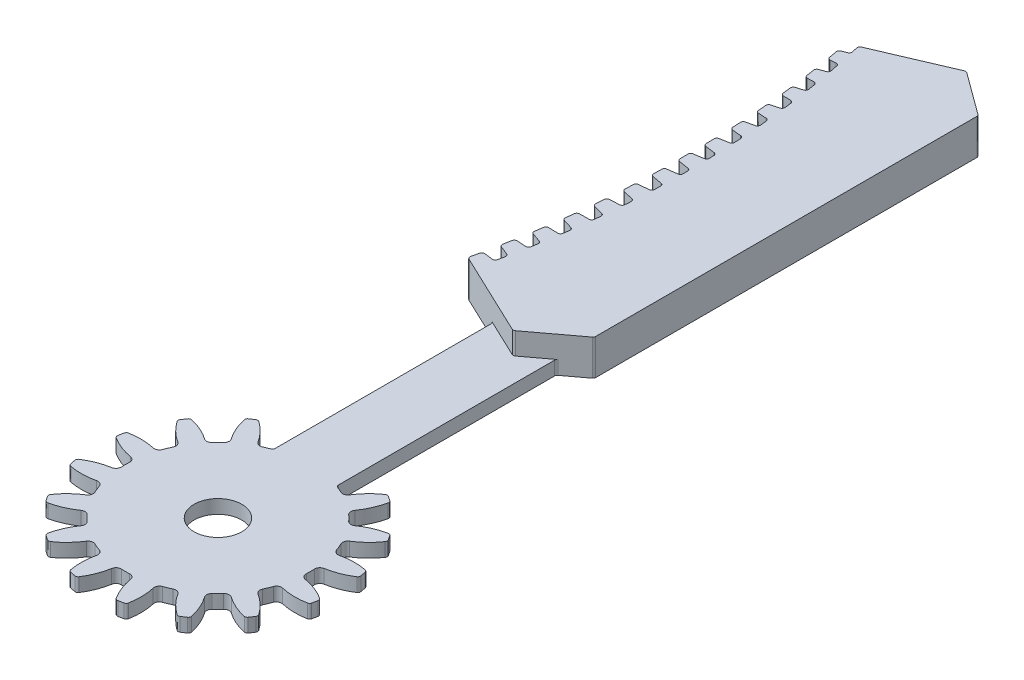
from build123d import *

# Parameters (mm, degrees)
SKETCH1_R                = 22.5
SKETCH1_R_2              = 4.35
BOSS_EXTRUDE1_DEPTH      = 2.5
CUT_EXTRUDE2_DEPTH       = 32.917863337009265
FILLET1_R                = 0.95
FILLET2_R                = 0.5
CIRPATTERN1_COUNT        = 16
FILLET1_OF_CIRPATTERN1_R = 0.95
FILLET2_OF_CIRPATTERN1_R = 0.5
BOSS_EXTRUDE3_DEPTH      = 2.5
BOSS_EXTRUDE4_DEPTH      = 6.5
FILLET5_R                = 0.5
BOSS_EXTRUDE5_DEPTH      = 6.5
FILLET6_R                = 0.5


with BuildPart() as part:
    # Sketch1 → Boss-Extrude1 (new body)
    with BuildSketch(Plane(origin=(0, 0, 0), x_dir=(1, 0, 0), z_dir=(0, 1, 0))):
        with Locations(Location((0, 0, 0), (0, 0, 270))):
            Circle(SKETCH1_R)
        with Locations(Location((0, 0, 0), (0, 0, 270))):
            Circle(SKETCH1_R_2, mode=Mode.SUBTRACT)
    extrude(amount=BOSS_EXTRUDE1_DEPTH)

    # Sketch3 → Cut-Extrude2 (cut, through all)
    with BuildSketch(Plane(origin=(0, 2.5, 0), x_dir=(1, 0, 0), z_dir=(0, 1, 0))):
        with BuildLine():
            ThreePointArc((1.605916203506758, 16.798412369843604), (-2.71e-15, 16.875000000000004), (-1.605916203506762, 16.798412369843604))
            ThreePointArc((-1.605916203506762, 16.798412369843604), (-2.2460398817052827, 19.63184994026773), (-3.5769752582013883, 22.213852615028653))
            ThreePointArc((-3.5769752582013883, 22.213852615028653), (1.38e-15, 22.500000000000004), (3.5769752582013874, 22.213852615028657))
            ThreePointArc((3.5769752582013874, 22.213852615028657), (2.246039881705281, 19.63184994026773), (1.605916203506758, 16.798412369843604))
        make_face()
    cut_extrude2 = extrude(amount=-CUT_EXTRUDE2_DEPTH, mode=Mode.SUBTRACT)

    # Fillet1
    fillet1_edges = [part.edges().sort_by_distance(p)[0] for p in [
        (1.6059162035067573, 1.25, -16.798412369843604),
        (-1.6059162035067611, 1.25, -16.798412369843604),
    ]]
    fillet(fillet1_edges, radius=FILLET1_R)

    # Fillet2
    fillet2_edges = [part.edges().sort_by_distance(p)[0] for p in [
        (-3.5769752582013874, 1.25, -22.213852615028653),
        (3.5769752582013874, 1.25, -22.213852615028657),
    ]]
    fillet(fillet2_edges, radius=FILLET2_R)

    # CirPattern1: Cut-Extrude2 ×16 about axis
    cirpattern1_axis = Axis((-6.88e-15, 0, 0), (0, 1, 0))
    for i in range(1, CIRPATTERN1_COUNT):
        add(cut_extrude2.rotate(cirpattern1_axis, i * 360 / CIRPATTERN1_COUNT), mode=Mode.SUBTRACT)

    # Fillet1 of CirPattern1
    fillet1_of_cirpattern1_edges = [part.edges().sort_by_distance(p)[0] for p in [
        (-4.94480099262781, 1.25, -16.134266892031608),
        (-7.91214721532406, 1.25, -14.905151842334245),
        (-10.74271706236741, 1.25, -13.013825537401383),
        (-13.013825537401381, 1.25, -10.742717062367413),
        (-14.905151842334249, 1.25, -7.912147215324063),
        (-16.134266892031608, 1.25, -4.944800992627813),
        (-16.79841236984361, 1.25, -1.6059162035067653),
        (-16.79841236984361, 1.25, 1.6059162035067531),
        (-16.134266892031615, 1.2499999999999998, 4.944800992627802),
        (-14.905151842334252, 1.2499999999999998, 7.912147215324052),
        (-13.01382553740139, 1.25, 10.742717062367403),
        (-10.74271706236742, 1.25, 13.013825537401374),
        (-7.912147215324071, 1.25, 14.905151842334243),
        (-4.944800992627821, 1.25, 16.134266892031604),
        (-1.605916203506773, 1.25, 16.798412369843604),
        (1.6059162035067454, 1.25, 16.798412369843604),
        (4.944800992627793, 1.25, 16.13426689203161),
        (7.912147215324044, 1.25, 14.905151842334247),
        (10.742717062367396, 1.25, 13.013825537401384),
        (13.013825537401367, 1.25, 10.742717062367415),
        (14.905151842334238, 1.25, 7.912147215324057),
        (16.134266892031597, 1.25, 4.944800992627807),
        (16.798412369843597, 1.25, 1.6059162035067673),
        (16.798412369843597, 1.25, -1.6059162035067511),
        (16.1342668920316, 1.25, -4.9448009926278065),
        (14.905151842334238, 1.25, -7.912147215324056),
        (13.013825537401377, 1.25, -10.7427170623674),
        (10.742717062367408, 1.25, -13.013825537401372),
        (7.912147215324052, 1.25, -14.905151842334245),
        (4.944800992627801, 1.25, -16.134266892031604),
    ]]
    fillet(fillet1_of_cirpattern1_edges, radius=FILLET1_OF_CIRPATTERN1_R)

    # Fillet2 of CirPattern1
    fillet2_of_cirpattern1_edges = [part.edges().sort_by_distance(p)[0] for p in [
        (-11.805567594122927, 1.25, -19.154074599953788),
        (-5.1961791354198565, 1.25, -21.891772938540814),
        (-18.236869281575988, 1.25, -13.178262359154587),
        (-13.178262359154582, 1.25, -18.23686928157599),
        (-21.89177293854081, 1.25, -5.196179135419862),
        (-19.15407459995379, 1.25, -11.805567594122936),
        (-22.21385261502866, 1.25, 3.5769752582013794),
        (-22.213852615028664, 1.25, -3.5769752582013954),
        (-19.154074599953795, 1.2499999999999998, 11.805567594122918),
        (-21.89177293854082, 1.2499999999999998, 5.196179135419848),
        (-13.178262359154594, 1.25, 18.23686928157598),
        (-18.236869281576, 1.25, 13.178262359154575),
        (-5.196179135419869, 1.25, 21.891772938540804),
        (-11.805567594122943, 1.25, 19.154074599953784),
        (3.576975258201371, 1.25, 22.213852615028653),
        (-3.576975258201404, 1.25, 22.213852615028657),
        (11.805567594122914, 1.25, 19.15407459995379),
        (5.196179135419838, 1.25, 21.891772938540814),
        (18.236869281575974, 1.25, 13.178262359154589),
        (13.178262359154568, 1.25, 18.236869281575995),
        (21.891772938540797, 1.25, 5.196179135419854),
        (19.154074599953784, 1.25, 11.80556759412293),
        (22.213852615028646, 1.25, -3.5769752582013767),
        (22.21385261502865, 1.25, 3.576975258201398),
        (19.15407459995378, 1.25, -11.805567594122925),
        (21.891772938540804, 1.25, -5.196179135419855),
        (13.178262359154582, 1.25, -18.236869281575977),
        (18.236869281575988, 1.25, -13.178262359154571),
        (5.196179135419847, 1.25, -21.891772938540804),
        (11.805567594122923, 1.25, -19.15407459995379),
    ]]
    fillet(fillet2_of_cirpattern1_edges, radius=FILLET2_OF_CIRPATTERN1_R)

    # Sketch4 → Boss-Extrude3 (add)
    with BuildSketch(Plane(origin=(0, 0, 0), x_dir=(1, 0, 0), z_dir=(0, 1, 0))):
        Polygon((1.2983995879278214, 52.50768205597929), (5.766865712416592, 55.85903164934587), (5.766865712416592, 15.859031649345871), (-5.766865712416817, 15.859031649345788), (-5.766865712416816, 55.85903164934579), align=None)
    extrude(amount=BOSS_EXTRUDE3_DEPTH)

    # Sketch4<3> → Boss-Extrude4 (add)
    with BuildSketch(Plane(origin=(0, 0, 0), x_dir=(1, 0, 0), z_dir=(0, 1, 0))):
        with BuildLine():
            Line((1.697049821836042, 134.76479760238988), (-12.09142103275468, 128.85903164934578))
            ThreePointArc((-12.09142103275468, 128.85903164934578), (-7.950942490902349, 93.85903164934585), (-12.09142103275358, 58.85903164934579))
            Line((-12.09142103275358, 58.85903164934579), (-5.766865712416816, 55.85903164934579))
            Line((-5.766865712416816, 55.85903164934579), (1.2983995879278214, 52.50768205597929))
            Line((1.2983995879278214, 52.50768205597929), (5.766865712416592, 55.85903164934587))
            Line((5.766865712416592, 55.85903164934587), (9.76686571241659, 58.85903164934587))
            Line((9.76686571241659, 58.85903164934587), (9.76686571241659, 128.8590316493459))
            Line((9.76686571241659, 128.8590316493459), (1.697049821836042, 134.76479760238988))
        make_face()
    extrude(amount=BOSS_EXTRUDE4_DEPTH)

    # Fillet5
    fillet5_edges = [part.edges().sort_by_distance(p)[0] for p in [
        (-5.7668657124168075, 1.2500000000000002, -15.859031649345795),
        (5.766865712416803, 1.2499999999999998, -15.859031649345793),
        (5.766865712416592, 1.25, -55.85903164934587),
        (-5.766865712416816, 1.25, -55.85903164934579),
        (1.697049821836042, 3.25, -134.76479760238988),
        (1.2983995879278214, 4.5, -52.50768205597929),
        (9.76686571241659, 3.25, -58.85903164934587),
        (9.76686571241659, 3.25, -128.8590316493459),
    ]]
    fillet(fillet5_edges, radius=FILLET5_R)

    # Sketch6 → Boss-Extrude5 (add)
    with BuildSketch(Plane(origin=(0, 0, 0), x_dir=(1, 0, 0), z_dir=(0, 1, 0))):
        with BuildLine():
            ThreePointArc((-13.87426551360329, 62.12954983497174), (-14.108237815682912, 61.02914144240931), (-14.350190790016683, 59.93046022077435))
            Line((-14.35019079001671, 59.93046022077435), (-12.09142103275358, 58.85903164934578))
            ThreePointArc((-12.091421032753573, 58.85903164934578), (-11.745508991646659, 60.333351711500036), (-11.41449869428186, 61.81108882238673))
            Line((-11.414498694281876, 61.81108882238673), (-13.87426551360333, 62.12954983497174))
        make_face()
        with BuildLine():
            Line((-12.925824147474163, 124.10752568322631), (-10.39160403870473, 124.26799571731279))
            ThreePointArc((-10.391604038704742, 124.26799571731279), (-10.67772165376428, 125.79013519452424), (-10.979540373734352, 127.30923931801563))
            Line((-10.979540373734338, 127.30923931801563), (-11.666221244835802, 127.03704138411108))
            Line((-11.666221244835802, 127.03704138411108), (-13.340138954285079, 126.37350616533111))
            ThreePointArc((-13.340138954285067, 126.37350616533111), (-13.128771984430784, 125.2412856068615), (-12.925824147474145, 124.10752568322631))
        make_face()
        with BuildLine():
            Line((-12.142011917300582, 119.16477330683823), (-9.559295134789458, 119.22617849462226))
            ThreePointArc((-9.559295134789437, 119.22617849462226), (-9.794490469822733, 120.76407589040942), (-10.045623786184734, 122.29945118752845))
            Line((-10.04562378618476, 122.29945118752845), (-12.482958165368771, 121.4429480060988))
            ThreePointArc((-12.482958165368757, 121.44294800609882), (-12.308252821395257, 120.30449404051488), (-12.142011917300579, 119.16477330683823))
        make_face()
        with BuildLine():
            Line((-11.518175015755538, 114.19929345220889), (-8.899179377850125, 114.15871855978668))
            ThreePointArc((-8.89917937785009, 114.15871855978668), (-9.082546978756739, 115.7093619712128), (-9.282046082505246, 117.25801260129856))
            Line((-9.282046082505268, 117.25801260129856), (-11.785397281387196, 116.48728745682806))
            ThreePointArc((-11.785397281387162, 116.48728745682806), (-11.64753568707215, 115.34378687974927), (-11.518175015755531, 114.19929345220889))
        make_face()
        with BuildLine():
            Line((-11.054963769443741, 109.21626244610927), (-8.412070592006991, 109.07181788575707))
            ThreePointArc((-8.412070592006984, 109.07181788575707), (-8.54289856830016, 110.6321415601842), (-8.690006881268403, 112.19101457381113))
            Line((-8.690006881268431, 112.19101457381113), (-11.248183483435511, 111.51169060803194))
            ThreePointArc((-11.248183483435497, 111.51169060803194), (-11.147309354327632, 110.36433547598111), (-11.05496376944373, 109.21626244610927))
        make_face()
        with BuildLine():
            Line((-10.752861058740207, 104.2208749117287), (-8.098537882823052, 103.97170589254574))
            ThreePointArc((-8.098537882823024, 103.97170589254574), (-8.176311205633965, 105.53860324167889), (-8.270467982568562, 107.10460148363794))
            Line((-8.27046798256858, 107.10460148363794), (-10.871876796777112, 106.52134433306908))
            ThreePointArc((-10.871876796777116, 106.52134433306908), (-10.808095290377736, 105.37133072079831), (-10.752861058740194, 104.2208749117287))
        make_face()
        with BuildLine():
            Line((-10.612181814405957, 99.21833835347418), (-7.958904637315803, 98.86462827676965))
            ThreePointArc((-7.958904637315783, 98.86462827676965), (-7.983307515275612, 100.4349650978318), (-8.024150533446516, 102.00496034620136))
            Line((-8.024150533446539, 102.00496034620136), (-10.656869507038714, 101.52145088102245))
            ThreePointArc((-10.656869507038692, 101.52145088102245), (-10.630247113179422, 100.36997763464986), (-10.612181814405943, 99.21833835347418))
        make_face()
        with BuildLine():
            ThreePointArc((-7.951026880501672, 94.01814441653903), (-7.96091969410088, 95.58907830044666), (-7.987264287578142, 97.15982242275447))
            Line((-7.987264287578148, 97.15982242275447), (-10.628690893228491, 96.74072690087189))
            ThreePointArc((-10.628690893228509, 96.74072690087189), (-10.611229790593597, 95.58907830044666), (-10.602326833132679, 94.4373317457242))
            Line((-10.602326833132677, 94.4373317457242), (-7.951026880501673, 94.01814441653903))
        make_face()
        with BuildLine():
            ThreePointArc((-8.024150533446544, 89.17319625469196), (-7.983307515275641, 90.74319150306152), (-7.958904637315811, 92.31352832412368))
            Line((-7.958904637315803, 92.31352832412368), (-10.612181814405957, 91.95981824741914))
            ThreePointArc((-10.612181814405943, 91.95981824741914), (-10.630247113179422, 90.80817896624346), (-10.656869507038692, 89.65670571987087))
            Line((-10.656869507038714, 89.65670571987087), (-8.024150533446539, 89.17319625469196))
        make_face()
        with BuildLine():
            ThreePointArc((-8.270467982568562, 84.0735551172554), (-8.176311205633965, 85.63955335921443), (-8.098537882823024, 87.20645070834757))
            Line((-8.098537882823052, 87.20645070834757), (-10.752861058740207, 86.95728168916463))
            ThreePointArc((-10.752861058740194, 86.95728168916463), (-10.808095290377736, 85.806825880095), (-10.871876796777116, 84.65681226782425))
            Line((-10.871876796777112, 84.65681226782425), (-8.27046798256858, 84.0735551172554))
        make_face()
        with BuildLine():
            ThreePointArc((-8.690006881268431, 78.9871420270822), (-8.54289856830016, 80.54601504070914), (-8.412070592006984, 82.10633871513626))
            Line((-8.412070592006991, 82.10633871513626), (-11.054963769443741, 81.96189415478405))
            ThreePointArc((-11.05496376944373, 81.96189415478405), (-11.147309354327632, 80.81382112491221), (-11.248183483435497, 79.66646599286138))
            Line((-11.248183483435511, 79.66646599286138), (-8.690006881268431, 78.9871420270822))
        make_face()
        with BuildLine():
            ThreePointArc((-9.282046082505246, 73.92014399959476), (-9.082546978756739, 75.46879462968052), (-8.89917937785009, 77.01943804110664))
            Line((-8.899179377850125, 77.01943804110664), (-11.518175015755538, 76.97886314868444))
            ThreePointArc((-11.518175015755531, 76.97886314868444), (-11.647535687072178, 75.83436972114406), (-11.78539728138719, 74.69086914406526))
            Line((-11.785397281387196, 74.69086914406526), (-9.282046082505268, 73.92014399959476))
        make_face()
        with BuildLine():
            ThreePointArc((-10.045623786184734, 68.87870541336488), (-9.794490469822733, 70.41408071048392), (-9.559295134789437, 71.95197810627104))
            Line((-9.559295134789458, 71.95197810627106), (-12.142011917300582, 72.0133832940551))
            ThreePointArc((-12.142011917300579, 72.0133832940551), (-12.308252821395229, 70.87366256037845), (-12.482958165368728, 69.73520859479453))
            Line((-12.482958165368771, 69.73520859479453), (-10.04562378618476, 68.87870541336488))
        make_face()
        with BuildLine():
            ThreePointArc((-10.979540373734352, 63.8689172828777), (-10.67772165376428, 65.38802140636909), (-10.391604038704742, 66.91016088358055))
            Line((-10.39160403870473, 66.91016088358055), (-12.925824147474163, 67.070630917667))
            ThreePointArc((-12.925824147474145, 67.07063091766699), (-13.128771984430784, 65.93687099403184), (-13.340138954285095, 64.80465043556224))
            Line((-13.340138954285079, 64.80465043556224), (-10.979540373734338, 63.8689172828777))
        make_face()
    extrude(amount=BOSS_EXTRUDE5_DEPTH)

    # Fillet6
    fillet6_edges = [part.edges().sort_by_distance(p)[0] for p in [
        (-11.414498694281853, 3.25, -61.81108882238673),
        (-13.874265513603325, 3.25, -62.12954983497174),
        (-14.350190790016725, 3.25, -59.93046022077435),
        (-10.6286908932285, 3.25, -96.74072690087189),
        (-10.602326833132679, 3.25, -94.4373317457242),
        (-7.951026880501672, 3.25, -94.01814441653903),
        (-7.987264287578131, 3.25, -97.15982242275447),
        (-10.752861058740201, 3.25, -86.95728168916463),
        (-10.871876796777128, 3.25, -84.65681226782425),
        (-8.27046798256857, 3.25, -84.0735551172554),
        (-8.098537882823052, 3.25, -87.20645070834757),
        (-12.091421032754681, 3.25, -128.85903164934578),
        (-12.925824147474168, 3.25, -124.10752568322631),
        (-11.05691508385047, 3.25, -124.22586737742502),
        (-13.340138954285074, 3.25, -126.37350616533111),
        (-11.666221244834901, 3.25, -127.0370413841114),
        (-12.14201191730058, 3.25, -119.16477330683823),
        (-10.109233080887918, 3.25, -119.21310348652288),
        (-12.482958165368764, 3.25, -121.44294800609882),
        (-10.632158891849429, 3.25, -122.09333700462747),
        (-11.51817501575555, 3.25, -114.19929345220889),
        (-9.33179649784941, 3.25, -114.16542089744999),
        (-11.78539728138718, 3.25, -116.48728745682806),
        (-9.763872039971716, 3.25, -117.1096693001893),
        (-11.054963769443722, 3.25, -109.21626244610927),
        (-8.726116741460402, 3.25, -109.08898174934997),
        (-11.24818348343549, 3.25, -111.51169060803194),
        (-9.063192944201575, 3.25, -112.09191499013482),
        (-10.752861058740216, 3.25, -104.2208749117287),
        (-8.293455501803152, 3.25, -103.99000337507664),
        (-10.871876796777128, 3.25, -106.52134433306908),
        (-8.531722909722873, 3.25, -107.04602599040834),
        (-10.612181814405936, 3.25, -99.21833835347418),
        (-8.034824017687583, 3.25, -98.87474913790189),
        (-10.656869507038689, 3.25, -101.52145088102245),
        (-8.170830341244141, 3.25, -101.97802200749823),
        (-7.958904637315808, 3.25, -92.31352832412368),
        (-10.612181814405936, 3.25, -91.95981824741914),
        (-10.656869507038703, 3.25, -89.65670571987087),
        (-8.02415053344654, 3.25, -89.17319625469196),
        (-8.412070592006987, 3.25, -82.10633871513626),
        (-11.054963769443736, 3.25, -81.96189415478405),
        (-11.248183483435504, 3.25, -79.66646599286138),
        (-8.690006881268445, 3.25, -78.9871420270822),
        (-8.899179377850093, 3.25, -77.01943804110664),
        (-11.51817501575552, 3.25, -76.97886314868444),
        (-11.785397281387166, 3.25, -74.69086914406526),
        (-9.282046082505257, 3.25, -73.92014399959476),
        (-9.559295134789448, 3.25, -71.95197810627104),
        (-12.14201191730058, 3.25, -72.0133832940551),
        (-12.48295816536875, 3.25, -69.73520859479453),
        (-10.045623786184734, 3.25, -68.87870541336488),
        (-13.340138954285102, 3.25, -64.80465043556225),
        (-10.97954037373433, 3.25, -63.8689172828777),
        (-10.39160403870472, 3.25, -66.91016088358055),
        (-12.925824147474154, 3.25, -67.07063091766699),
    ]]
    fillet(fillet6_edges, radius=FILLET6_R)


solid = part.part
